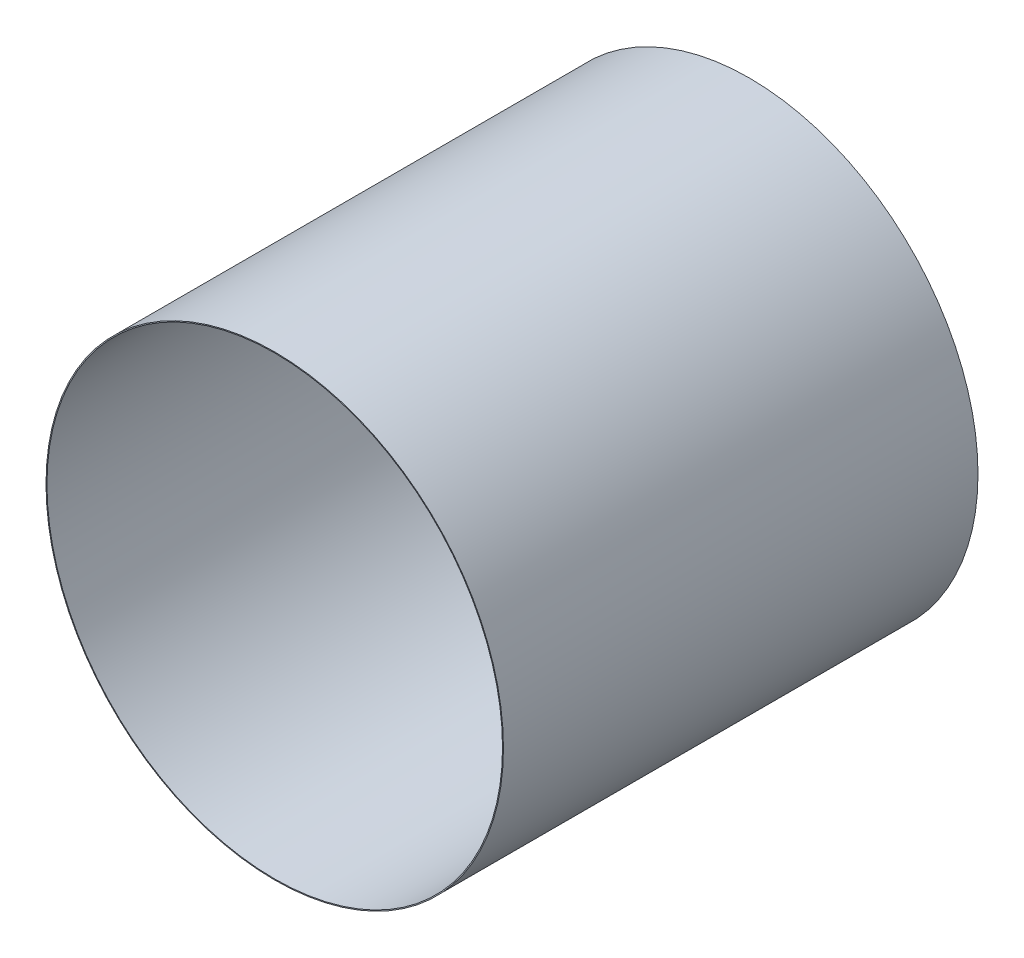
from build123d import *

# Parameters (mm, degrees)
SKETCH1_R           = 12.05
SKETCH1_R_2         = 12
BOSS_EXTRUDE1_DEPTH = 25


with BuildPart() as part:
    # Sketch1 → Boss-Extrude1 (new body)
    with BuildSketch(Plane.XY):
        Circle(SKETCH1_R)
        Circle(SKETCH1_R_2, mode=Mode.SUBTRACT)
    extrude(amount=BOSS_EXTRUDE1_DEPTH)


solid = part.part
